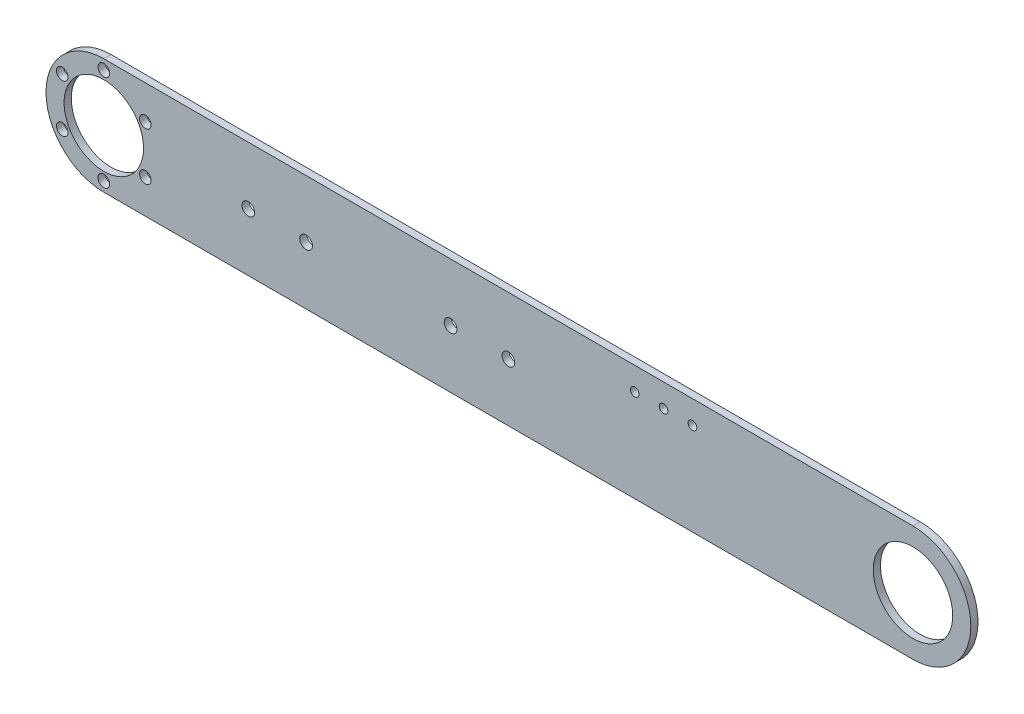
from build123d import *

# Parameters (mm, degrees)
BOSS_EXTRUDE1_DEPTH    = 3.175
SKETCH2_R              = 17.4625
CUT_EXTRUDE1_DEPTH     = 385.384860036
F_10_CLEARANCE_HOLE1_D = 5.1054
SKETCH6_R              = 2.794
CUT_EXTRUDE2_DEPTH     = 385.384860036
SKETCH7_R              = 1.905
CUT_EXTRUDE3_DEPTH     = 385.384860036


with BuildPart() as part:
    # Sketch1 → Boss-Extrude1 (new body)
    with BuildSketch(Plane.XY):
        with BuildLine():
            Line((0, 0), (355.6, 0))
            ThreePointArc((355.6, 0), (381, 25.4), (355.6, 50.8))
            Line((355.6, 50.8), (0, 50.8))
            ThreePointArc((0, 50.8), (-25.4, 25.4), (0, 0))
        make_face()
    extrude(amount=BOSS_EXTRUDE1_DEPTH)

    # Sketch2 → Cut-Extrude1 (cut, through all)
    with BuildSketch(Plane.XY.offset(3.175)):
        with Locations((0, 25.4)):
            Circle(SKETCH2_R)
        with Locations((355.6, 25.4)):
            Circle(SKETCH2_R)
    extrude(amount=-CUT_EXTRUDE1_DEPTH, mode=Mode.SUBTRACT)

    # #10 Clearance Hole1 (through all)
    with Locations(Plane(origin=(18.257547563, 35.941, 3.175), x_dir=(1, 0, 0), z_dir=(0, 0, 1))):
        with Locations((0, 0), (0, -21.082), (-18.257547563, -31.623), (-36.515095126, -21.082), (-36.515095126, 0), (-18.257547563, 10.541)):
            Hole(F_10_CLEARANCE_HOLE1_D / 2)

    # Sketch6 → Cut-Extrude2 (cut, through all)
    with BuildSketch(Plane.XY.offset(3.175)):
        with Locations((63.5, 25.4)):
            Circle(SKETCH6_R)
        with Locations((88.9, 25.4)):
            Circle(SKETCH6_R)
        with Locations((152.4, 25.4)):
            Circle(SKETCH6_R)
        with Locations((177.8, 25.4)):
            Circle(SKETCH6_R)
    extrude(amount=-CUT_EXTRUDE2_DEPTH, mode=Mode.SUBTRACT)

    # Sketch7 → Cut-Extrude3 (cut, through all)
    with BuildSketch(Plane.XY.offset(3.175)):
        with Locations((258.687715098, 40.64)):
            Circle(SKETCH7_R)
        with Locations((245.987715098, 40.64)):
            Circle(SKETCH7_R)
        with Locations((233.287715098, 40.64)):
            Circle(SKETCH7_R)
    extrude(amount=-CUT_EXTRUDE3_DEPTH, mode=Mode.SUBTRACT)


solid = part.part
